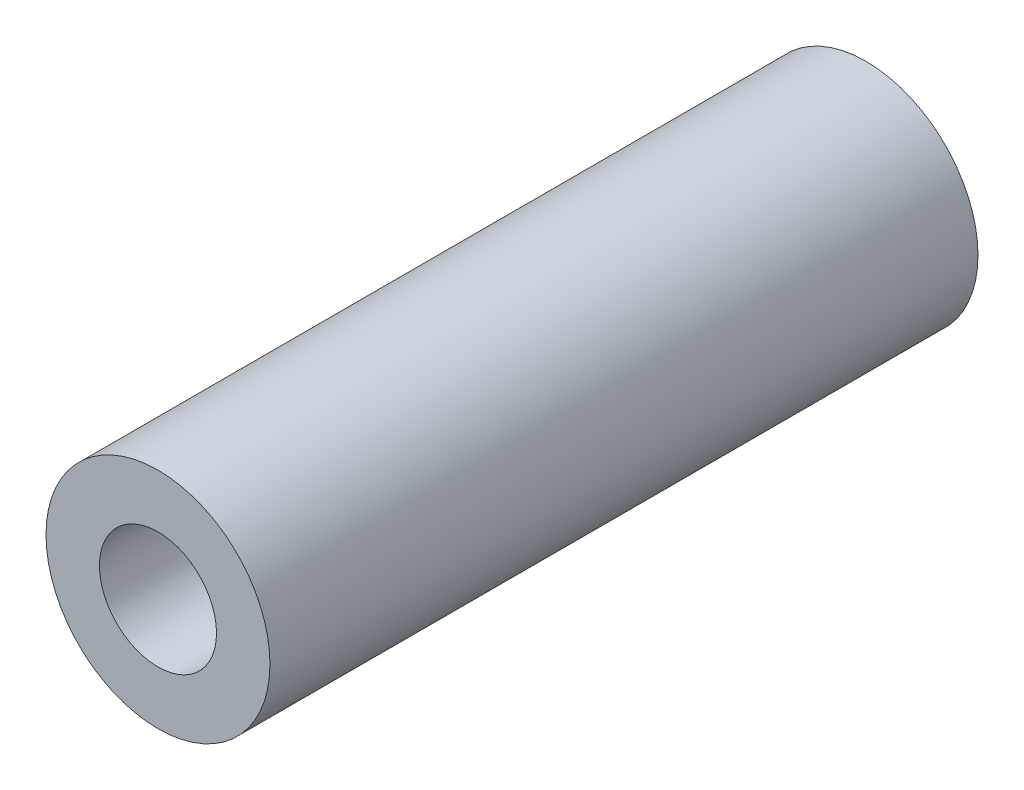
from build123d import *

# Parameters (mm, degrees)
SKETCH1_R           = 4.7625
SKETCH1_R_2         = 2.4892
BOSS_EXTRUDE1_DEPTH = 15.05585


with BuildPart() as part:
    # Sketch1 → Boss-Extrude1 (new, symmetric)
    with BuildSketch(Plane.XY):
        Circle(SKETCH1_R)
        Circle(SKETCH1_R_2, mode=Mode.SUBTRACT)
    extrude(amount=BOSS_EXTRUDE1_DEPTH, both=True)


solid = part.part
